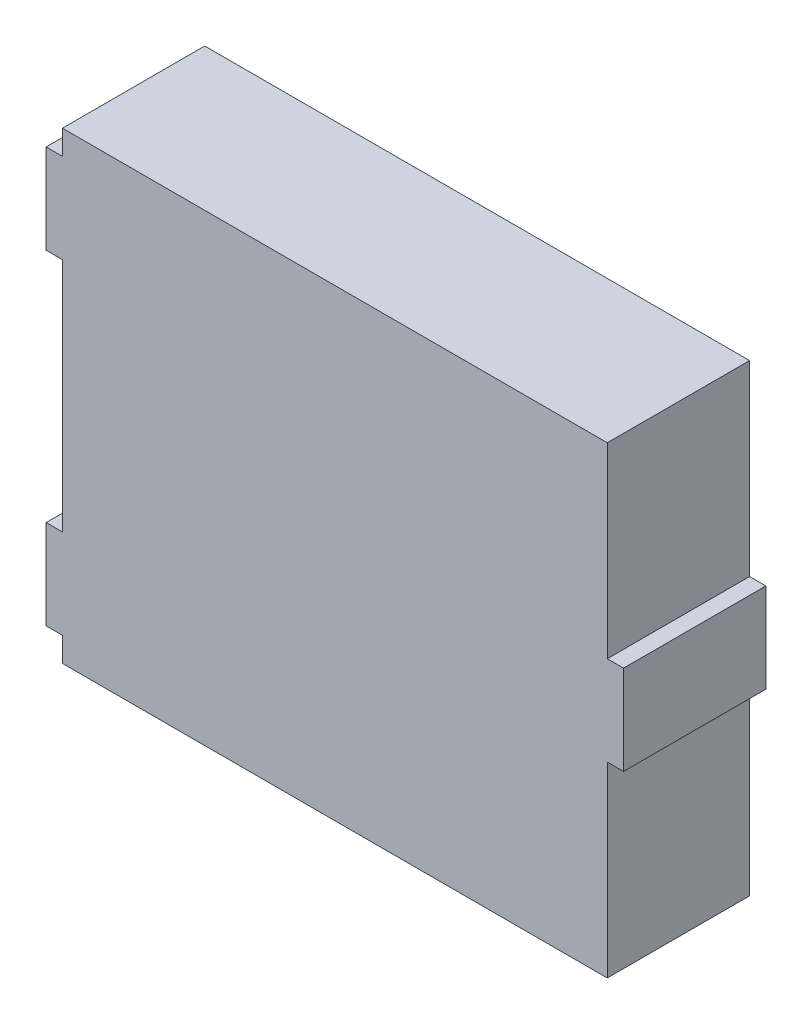
from build123d import *

# Parameters (mm, degrees)
COMPONENT_OUTLINE_DEPTH = 1.75


with BuildPart() as part:
    # 草图1 → Component_Outline (new body)
    with BuildSketch(Plane.XY):
        Polygon((-3.35, -2.85), (-3.35, -2.55), (-3.55, -2.55), (-3.55, -1.45), (-3.35, -1.45), (-3.35, 1.45), (-3.55, 1.45), (-3.55, 2.55), (-3.35, 2.55), (-3.35, 2.85), (3.35, 2.85), (3.35, 0.55), (3.55, 0.55), (3.55, -0.55), (3.35, -0.55), (3.35, -2.85), align=None)
    extrude(amount=COMPONENT_OUTLINE_DEPTH)


solid = part.part
